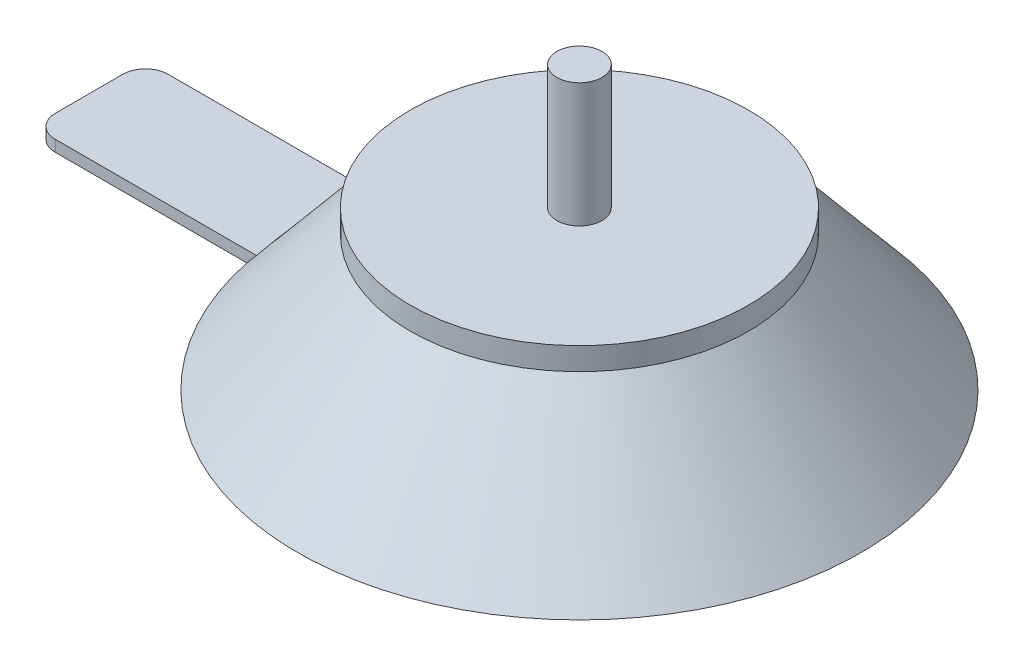
from build123d import *

# Parameters (mm, degrees)
BOSS_EXTRUDE1_DEPTH = 1
FILLET1_R           = 2


with BuildPart() as part:
    # Sketch1 → Revolve1 (revolve)
    with BuildSketch(Plane.XY):
        Polygon((0, 0), (-25, 0), (-15, 12), (-15, 14), (-2, 14), (-2, 25), (0, 25), align=None)
    revolve(axis=Axis((0, 25, 0), (0, -1, 0)))

    # Sketch2 → Boss-Extrude1 (add)
    with BuildSketch(Plane.XZ):
        Polygon((-24.494897428, 5), (-43.494897428, 5), (-43.494897428, -5), (-24.494897428, -5), (-19.595908881, -5), (-19.595908881, 5), align=None)
    extrude(amount=-BOSS_EXTRUDE1_DEPTH)

    # Fillet1
    fillet1_edges = [part.edges().sort_by_distance(p)[0] for p in [
        (-43.494897428, 0.5, -5),
        (-43.494897428, 0.5, 5),
    ]]
    fillet(fillet1_edges, radius=FILLET1_R)


solid = part.part
